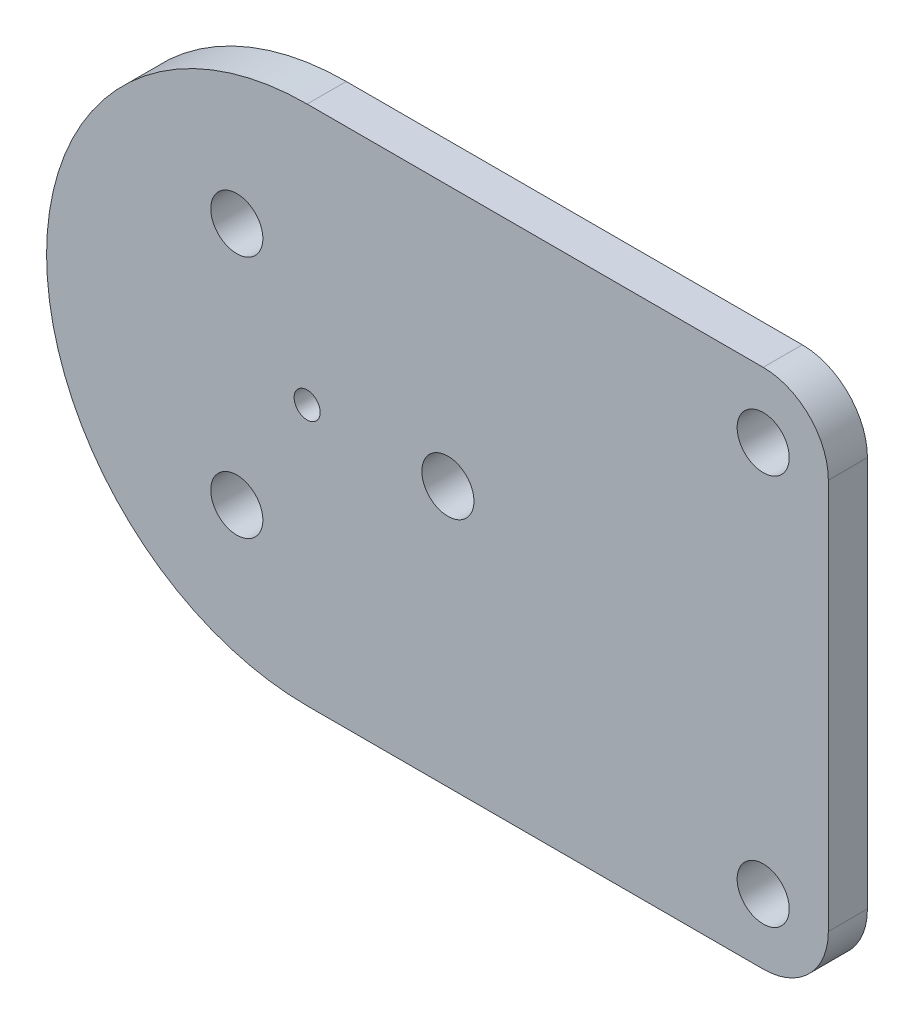
from build123d import *

# Parameters (mm, degrees)
SKIZZE1_R                       = 1
SKIZZE1_R_2                     = 2
AUFSATZ_LINEAR_AUSTRAGEN1_DEPTH = 3
SKIZZE2_R                       = 2
SCHNITT_LINEAR_AUSTRAGEN1_DEPTH = 45.821869662
VERRUNDUNG1_R                   = 5


with BuildPart() as part:
    # Skizze1 → Aufsatz-Linear austragen1 (new body)
    with BuildSketch(Plane.XY):
        with BuildLine():
            Line((40, 20), (0, 20))
            ThreePointArc((0, 20), (-20, 0), (0, -20))
            Line((0, -20), (40, -20))
            Line((40, -20), (40, 20))
        make_face()
        Circle(SKIZZE1_R, mode=Mode.SUBTRACT)
        with Locations((35, 15)):
            Circle(SKIZZE1_R_2, mode=Mode.SUBTRACT)
        with Locations((35, -15)):
            Circle(SKIZZE1_R_2, mode=Mode.SUBTRACT)
    extrude(amount=AUFSATZ_LINEAR_AUSTRAGEN1_DEPTH)

    # Skizze2 → Schnitt-Linear austragen1 (cut, through all)
    with BuildSketch(Plane(origin=(0, 0, 0), x_dir=(-1, 0, 0), z_dir=(0, 0, -1))):
        with Locations((-10.8, 0)):
            Circle(SKIZZE2_R)
        with Locations((5.4, 9.353074361)):
            Circle(SKIZZE2_R)
        with Locations((5.4, -9.353074361)):
            Circle(SKIZZE2_R)
    extrude(amount=-SCHNITT_LINEAR_AUSTRAGEN1_DEPTH, mode=Mode.SUBTRACT)

    # Verrundung1
    verrundung1_edges = [part.edges().sort_by_distance(p)[0] for p in [
        (40, 20, 1.5),
        (40, -20, 1.5),
    ]]
    fillet(verrundung1_edges, radius=VERRUNDUNG1_R)


solid = part.part
